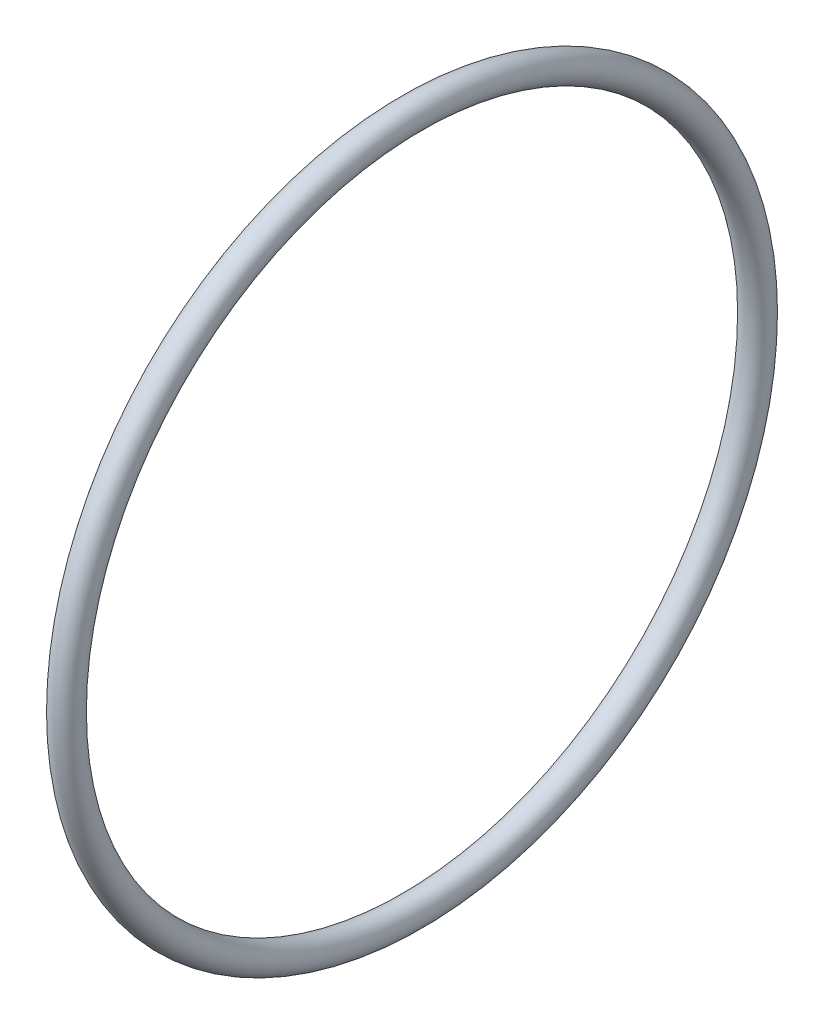
from build123d import *

# Parameters (mm, degrees)
SKETCH1_R = 1.27


with BuildPart() as part:
    # Sketch1 → Revolve2 (revolve)
    with BuildSketch(Plane.XY):
        with Locations((0, 31.115)):
            Circle(SKETCH1_R)
    revolve(axis=Axis((-22.180929287, 0, 0), (1, 0, 0)))


solid = part.part
